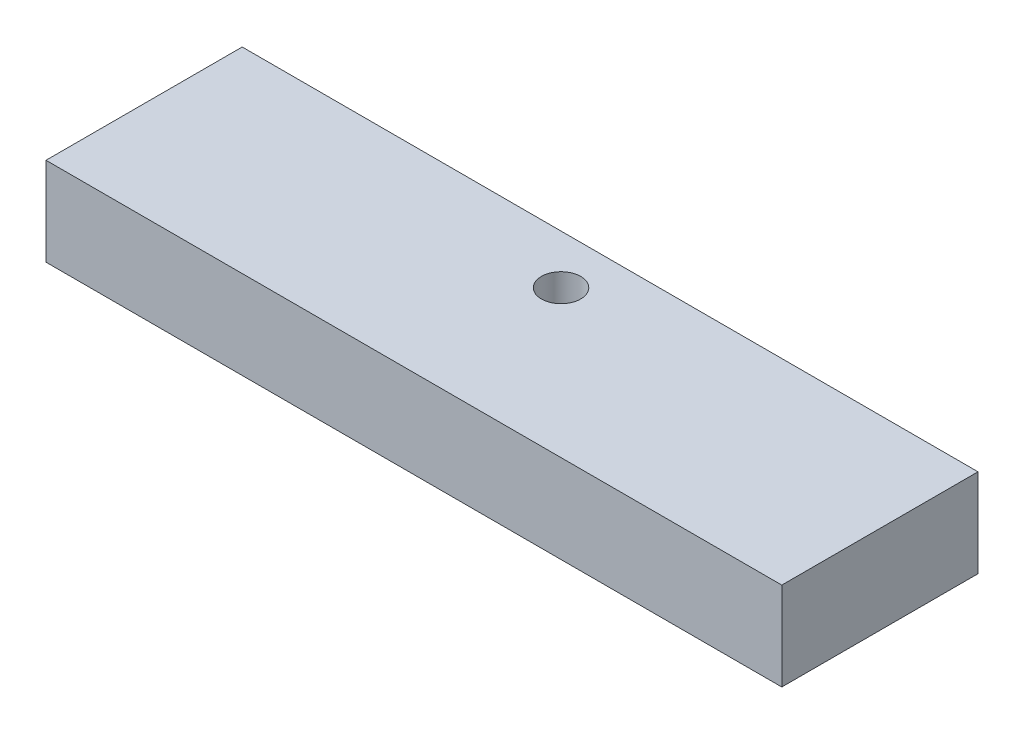
from build123d import *

# Parameters (mm, degrees)
SKETCH1_W           = 150
SKETCH1_H           = 40
SKETCH1_R           = 4
BOSS_EXTRUDE1_DEPTH = 18


with BuildPart() as part:
    # Sketch1 → Boss-Extrude1 (new body)
    with BuildSketch(Plane(origin=(0, 0, 0), x_dir=(1, 0, 0), z_dir=(0, 1, 0))):
        Rectangle(SKETCH1_W, SKETCH1_H)
        with Locations(Location((0, 10, 0), (0, 0, 270))):
            Circle(SKETCH1_R, mode=Mode.SUBTRACT)
    extrude(amount=BOSS_EXTRUDE1_DEPTH)


solid = part.part
